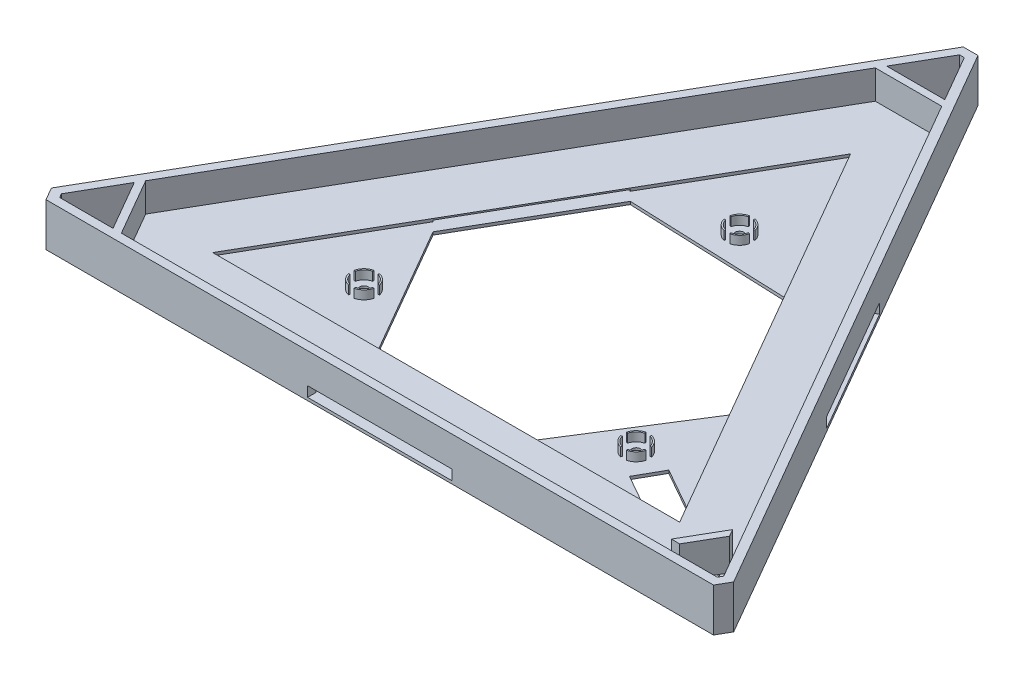
from build123d import *

# Parameters (mm, degrees)
BOSS_EXTRUDE1_DEPTH      = 1
BOSS_EXTRUDE2_DEPTH      = 11
BOSS_EXTRUDE3_DEPTH      = 5
BOSS_EXTRUDE3_DEPTH_BACK = 3
SKETCH3_W                = 50
SKETCH3_H                = 7
CUT_EXTRUDE3_DEPTH       = 25
SKETCH5_W                = 50
SKETCH5_H                = 7
CUT_EXTRUDE4_DEPTH       = 25
SKETCH6_W                = 50
SKETCH6_H                = 7
CUT_EXTRUDE5_DEPTH       = 25
SKETCH8_R                = 1.5
BOSS_EXTRUDE5_DEPTH      = 1
BOSS_EXTRUDE10_DEPTH     = 3


with BuildPart() as part:
    # Sketch1 → Boss-Extrude1 (new body)
    with BuildSketch(Plane(origin=(0, 0, 0), x_dir=(1, 0, 0), z_dir=(0, 1, 0))):
        Polygon((243.304219773, -116.484791866), (254.809280576, -136.408896139), (442.602090749, -136.409305398), (444.621046679, -132.925433223), (441.749040748, -132.925433223), (449.516726723, -119.471406457), (450.964695297, -121.978953122), (452.699916621, -118.984688017), (358.778179035, 43.666038066), (335.767496284, 43.666038066), align=None)
        Polygon((428.113670919, -116.417164681), (266.439108268, -116.428009241), (347.273609729, 23.609230825), align=None, mode=Mode.SUBTRACT)
    extrude(amount=BOSS_EXTRUDE1_DEPTH)

    # Sketch1<9> → Boss-Extrude2 (add)
    # profile 1 of 2: a face of its own
    with BuildSketch(Plane(origin=(0, 0, 0), x_dir=(1, 0, 0), z_dir=(0, 1, 0))):
        Polygon((229.159432547, -134.984249184), (231.716666588, -139.412373829), (462.829865412, -139.412373829), (465.38624875, -134.984588004), (349.829542096, 65.165499075), (344.716133219, 65.165499075), align=None)
        Polygon((251.922647988, -136.4093054), (233.446303399, -136.408896139), (232.623553959, -134.984217358), (241.860901688, -118.984688019), align=None, mode=Mode.SUBTRACT)
        Polygon((442.602090749, -136.409305398), (254.809280576, -136.408896139), (243.304219773, -116.484791866), (335.767496284, 43.666038066), (358.778179035, 43.666038066), (461.938967957, -134.984588004), (461.116393748, -136.409305398), align=None, mode=Mode.SUBTRACT)
        Polygon((348.096628302, 62.164013367), (357.334800991, 46.166038067), (337.210874326, 46.166038067), (346.44844193, 62.165948237), align=None, mode=Mode.SUBTRACT)
    # profile 2 of 2: a face of its own
    with BuildSketch(Plane(origin=(0, 0, 0), x_dir=(1, 0, 0), z_dir=(0, 1, 0))):
        Polygon((441.749040748, -132.925433223), (444.621046679, -132.925433223), (450.964695297, -121.978953122), (449.516726723, -119.471406457), align=None)
    extrude(amount=BOSS_EXTRUDE2_DEPTH)

    # Sketch1<10> → Boss-Extrude3 (add, two sides: drawn at the far end of the back side and taken through both)
    with BuildSketch(Plane(origin=(0, 0, 0), x_dir=(1, 0, 0), z_dir=(0, 1, 0)).offset(-BOSS_EXTRUDE3_DEPTH_BACK)):
        Polygon((229.159432547, -134.984249184), (231.716666588, -139.412373829), (462.829865412, -139.412373829), (465.38624875, -134.984588004), (349.829542096, 65.165499075), (344.716133219, 65.165499075), align=None)
        Polygon((251.922647988, -136.4093054), (233.446303399, -136.408896139), (232.623553959, -134.984217358), (241.860901688, -118.984688019), align=None, mode=Mode.SUBTRACT)
        Polygon((442.602090749, -136.409305398), (254.809280576, -136.408896139), (243.304219773, -116.484791866), (335.767496284, 43.666038066), (358.778179035, 43.666038066), (452.699916621, -118.984688017), (461.938967957, -134.984588004), (461.116393748, -136.409305398), align=None, mode=Mode.SUBTRACT)
        Polygon((348.096628302, 62.164013367), (357.334800991, 46.166038067), (337.210874326, 46.166038067), (346.44844193, 62.165948237), align=None, mode=Mode.SUBTRACT)
    extrude(amount=BOSS_EXTRUDE3_DEPTH + BOSS_EXTRUDE3_DEPTH_BACK)

    # Sketch3 → Cut-Extrude3 (cut)
    with BuildSketch(Plane(origin=(290.589645397, 0, -167.772009994), x_dir=(-0.49999999999998745, 0, -0.8660254037844459), z_dir=(0.8660254037844459, 0, -0.49999999999998745))):
        with Locations((-236.592990632, -3)):
            Rectangle(SKETCH3_W, SKETCH3_H)
    extrude(amount=-CUT_EXTRUDE3_DEPTH, mode=Mode.SUBTRACT)

    # Sketch5 → Cut-Extrude4 (cut)
    with BuildSketch(Plane.XY.offset(139.412373829)):
        with Locations((347.273266, -3)):
            Rectangle(SKETCH5_W, SKETCH5_H)
    extrude(amount=-CUT_EXTRUDE4_DEPTH, mode=Mode.SUBTRACT)

    # Sketch6 → Cut-Extrude5 (cut)
    with BuildSketch(Plane(origin=(230.319375797, 0, 132.975171838), x_dir=(-0.5000006154012504, 0, 0.8660250484820695), z_dir=(-0.8660250484820695, 0, -0.5000006154012504))):
        with Locations((-113.2366748, -3)):
            Rectangle(SKETCH6_W, SKETCH6_H)
    extrude(amount=-CUT_EXTRUDE5_DEPTH, mode=Mode.SUBTRACT)

    # Sketch8 → Boss-Extrude5 (add)
    with BuildSketch(Plane.XZ.offset(3)):
        Polygon((349.829542096, -65.165499075), (465.38624875, 134.984588004), (462.829865412, 139.412373829), (231.716666588, 139.412373829), (229.159432547, 134.984249184), (344.716133219, -65.165499075), align=None)
        with Locations((395.323540807, 98.692824234)):
            Circle(SKETCH8_R, mode=Mode.SUBTRACT)
        with Locations((348.301285092, 15.863526629)):
            Circle(SKETCH8_R, mode=Mode.SUBTRACT)
        with Locations((299.654911442, 97.241681781)):
            Circle(SKETCH8_R, mode=Mode.SUBTRACT)
        Polygon((450.14703547, 123.280701064), (452.699916621, 118.984688017), (461.938967957, 134.984588004), (461.116393748, 136.409305398), (442.602090749, 136.409305398), (445.226665069, 131.986443715), (401.697951811, 107.384591709), (406.618322212, 98.678849058), align=None, mode=Mode.SUBTRACT)
        Polygon((322.273266, 116.424264082), (294.358218631, 68.061097964), (319.354499366, 24.757680453), (376.473657317, 26.969372805), (401.47267951, 70.271207531), (372.273266, 116.420910258), align=None, mode=Mode.SUBTRACT)
        Polygon((233.446303399, 136.408896139), (251.922647988, 136.4093054), (241.860901688, 118.984688019), (232.623553959, 134.984217358), align=None, mode=Mode.SUBTRACT)
        Polygon((337.210874326, -46.166038067), (357.334800991, -46.166038067), (348.096628302, -62.164013367), (346.44844193, -62.165948237), align=None, mode=Mode.SUBTRACT)
    extrude(amount=BOSS_EXTRUDE5_DEPTH)

    # Sketch12 → Boss-Extrude10 (add)
    with BuildSketch(Plane(origin=(0, -3, 0), x_dir=(1, 0, 0), z_dir=(0, 1, 0))):
        with BuildLine():
            ThreePointArc((352.69017398, -14.869718639), (351.483265607, -12.681546113), (349.295093082, -11.47463774))
            Line((349.295093082, -11.47463774), (349.184669972, -11.962292061))
            ThreePointArc((349.184669972, -11.962292061), (351.129712216, -13.035099504), (352.202519659, -14.980141749))
            Line((352.202519659, -14.980141749), (352.69017398, -14.869718639))
        make_face()
        with BuildLine():
            Line((347.417900212, -11.962292061), (347.307477102, -11.47463774))
            ThreePointArc((347.307477102, -11.47463774), (345.119304576, -12.681546113), (343.912396203, -14.869718639))
            Line((343.912396203, -14.869718639), (344.400050524, -14.980141749))
            ThreePointArc((344.400050524, -14.980141749), (345.472857967, -13.035099504), (347.417900212, -11.962292061))
        make_face()
        with BuildLine():
            ThreePointArc((349.295093082, -20.252415518), (351.483265607, -19.045507144), (352.69017398, -16.857334619))
            Line((352.69017398, -16.857334619), (352.202519659, -16.746911509))
            ThreePointArc((352.202519659, -16.746911509), (351.129712216, -18.691953754), (349.184669972, -19.764761197))
            Line((349.184669972, -19.764761197), (349.295093082, -20.252415518))
        make_face()
        with BuildLine():
            Line((344.400050524, -16.746911509), (343.912396203, -16.857334619))
            ThreePointArc((343.912396203, -16.857334619), (345.119304576, -19.045507144), (347.307477102, -20.252415518))
            Line((347.307477102, -20.252415518), (347.417900212, -19.764761197))
            ThreePointArc((347.417900212, -19.764761197), (345.472857967, -18.691953754), (344.400050524, -16.746911509))
        make_face()
        with BuildLine():
            Line((394.440155927, -94.791589666), (394.329732817, -94.303935345))
            ThreePointArc((394.329732817, -94.303935345), (392.141560292, -95.510843719), (390.934651919, -97.699016244))
            Line((390.934651919, -97.699016244), (391.4247896, -97.798542945))
            ThreePointArc((391.4247896, -97.798542945), (392.499067689, -95.860448622), (394.440155927, -94.791589666))
        make_face()
        with BuildLine():
            ThreePointArc((399.712429696, -97.699016244), (398.505521323, -95.510843719), (396.317348797, -94.303935345))
            Line((396.317348797, -94.303935345), (396.206925687, -94.791589666))
            ThreePointArc((396.206925687, -94.791589666), (398.151967932, -95.864397109), (399.224775375, -97.809439354))
            Line((399.224775375, -97.809439354), (399.712429696, -97.699016244))
        make_face()
        with BuildLine():
            Line((391.422306239, -99.576209114), (390.934651919, -99.686632224))
            ThreePointArc((390.934651919, -99.686632224), (392.141560292, -101.874804749), (394.329732817, -103.081713123))
            Line((394.329732817, -103.081713123), (394.440155927, -102.594058802))
            ThreePointArc((394.440155927, -102.594058802), (392.495113683, -101.521251359), (391.422306239, -99.576209114))
        make_face()
        with BuildLine():
            ThreePointArc((396.317348797, -103.081713123), (398.505521323, -101.874804749), (399.712429696, -99.686632224))
            Line((399.712429696, -99.686632224), (399.224775375, -99.576209114))
            ThreePointArc((399.224775375, -99.576209114), (398.151967932, -101.521251359), (396.206925687, -102.594058802))
            Line((396.206925687, -102.594058802), (396.317348797, -103.081713123))
        make_face()
        with BuildLine():
            ThreePointArc((298.661103452, -92.852792892), (296.472930927, -94.059701266), (295.266022553, -96.247873791))
            Line((295.266022553, -96.247873791), (295.753676874, -96.358296901))
            ThreePointArc((295.753676874, -96.358296901), (296.826484317, -94.413254657), (298.771526562, -93.340447213))
            Line((298.771526562, -93.340447213), (298.661103452, -92.852792892))
        make_face()
        with BuildLine():
            Line((295.753676874, -98.125066661), (295.266022553, -98.235489771))
            ThreePointArc((295.266022553, -98.235489771), (296.472930927, -100.423662297), (298.661103452, -101.63057067))
            Line((298.661103452, -101.63057067), (298.771526562, -101.142916349))
            ThreePointArc((298.771526562, -101.142916349), (296.826484317, -100.070108906), (295.753676874, -98.125066661))
        make_face()
        with BuildLine():
            ThreePointArc((304.043800331, -96.247873791), (302.836891957, -94.059701266), (300.648719432, -92.852792892))
            Line((300.648719432, -92.852792892), (300.538296322, -93.340447213))
            ThreePointArc((300.538296322, -93.340447213), (302.483338567, -94.413254657), (303.55614601, -96.358296901))
            Line((303.55614601, -96.358296901), (304.043800331, -96.247873791))
        make_face()
        with BuildLine():
            Line((300.538296322, -101.142916349), (300.648719432, -101.63057067))
            ThreePointArc((300.648719432, -101.63057067), (302.836891957, -100.423662297), (304.043800331, -98.235489771))
            Line((304.043800331, -98.235489771), (303.55614601, -98.125066661))
            ThreePointArc((303.55614601, -98.125066661), (302.483338567, -100.070108906), (300.538296322, -101.142916349))
        make_face()
    extrude(amount=BOSS_EXTRUDE10_DEPTH)


solid = part.part
